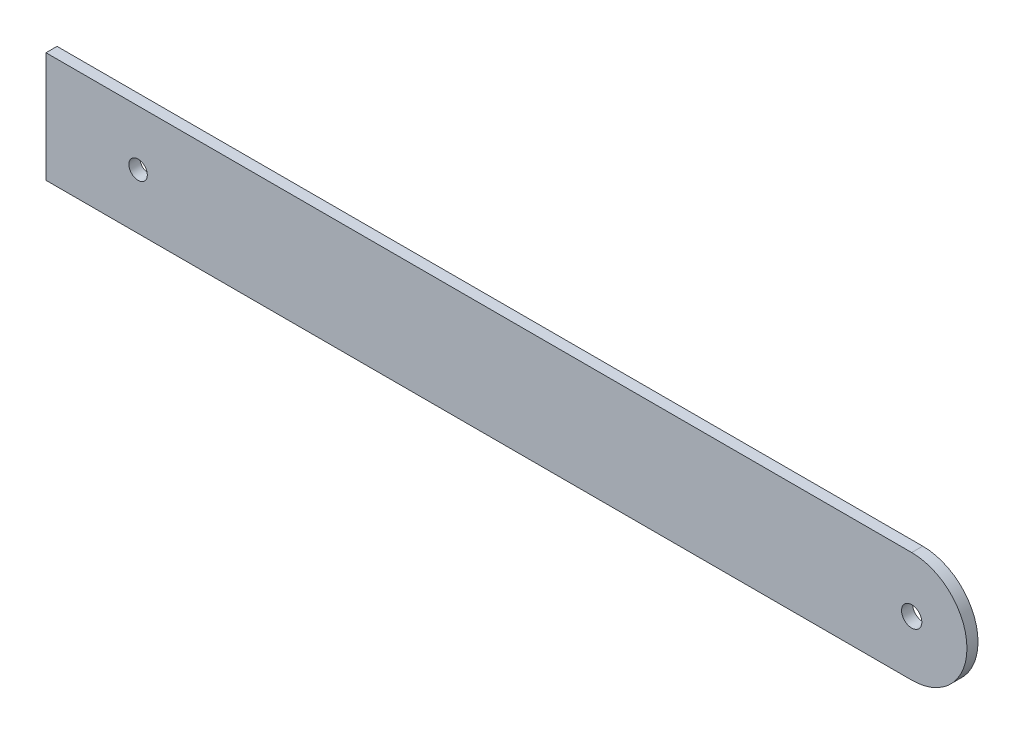
from build123d import *

# Parameters (mm, degrees)
SKETCH_1_R      = 2.75
SKETCH_1_R_2    = 2.5
EXTRUDE_1_DEPTH = 3


with BuildPart() as part:
    # 草图1 → 凸台-拉伸1 (new body)
    with BuildSketch(Plane.XY):
        with BuildLine():
            Line((0, 0), (235, 0))
            ThreePointArc((235, 0), (250, -15), (235, -30))
            Line((235, -30), (0, -30))
            Line((0, -30), (0, 0))
        make_face()
        with Locations((235, -15)):
            Circle(SKETCH_1_R, mode=Mode.SUBTRACT)
        with Locations((25, -15)):
            Circle(SKETCH_1_R_2, mode=Mode.SUBTRACT)
    extrude(amount=EXTRUDE_1_DEPTH)


solid = part.part
